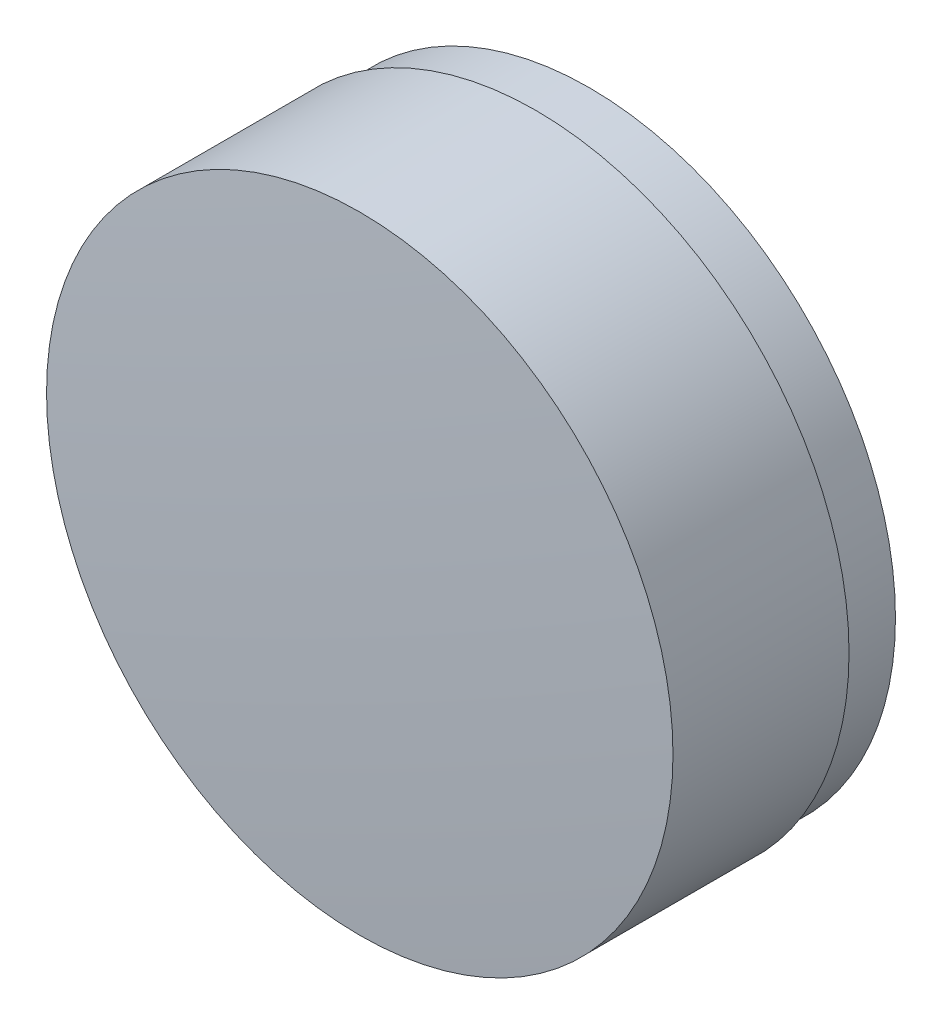
from build123d import *


with BuildPart() as part:
    # Sketch1 → Revolve1 (revolve)
    with BuildSketch(Plane(origin=(0, 0, 0), x_dir=(0, 0, -1), z_dir=(1, 0, 0)), mode=Mode.PRIVATE) as revolve1_sk:
        with BuildLine():
            Line((0.686397429, 5.35), (-0.25, 5.35))
            Line((-0.25, 5.35), (-0.25, 5.475))
            Line((-0.25, 5.475), (-3.327304694, 5.475))
            ThreePointArc((-3.327304694, 5.475), (-3.449317198, 2.738708398), (-3.49, 0))
            Line((-3.49, 0), (0, 0))
            ThreePointArc((0, 0), (0.172299759, 2.696926094), (0.686397429, 5.35))
        make_face()
    revolve(revolve1_sk.sketch.rotate(Axis((0, 0, -2.169107761), (0, 0, 1)), 90), axis=Axis((0, 0, -2.169107761), (0, 0, 1)))


solid = part.part
